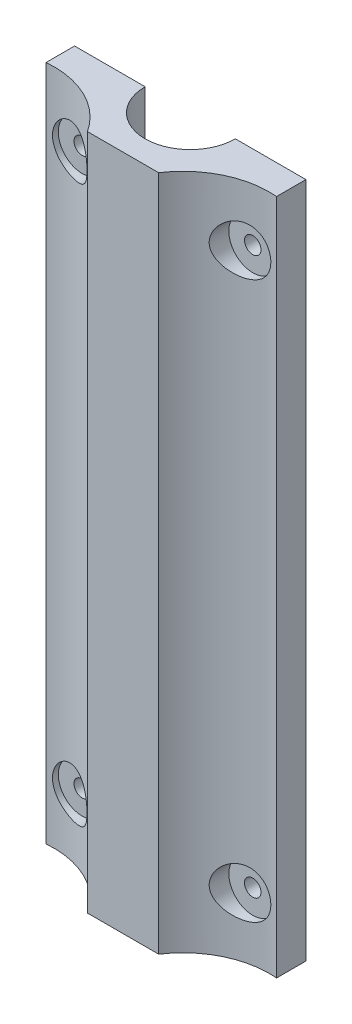
from build123d import *

# Parameters (mm, degrees)
ROTATION1_ANGLE                                     = 180
SCHNITT_LINEAR_AUSTRAGEN2_DEPTH                     = 92.33454987
SCHNITT_LINEAR_AUSTRAGEN2_DEPTH_BACK                = 90
SCHNITT_LINEAR_AUSTRAGEN3_DEPTH                     = 92.33454987
SCHNITT_LINEAR_AUSTRAGEN3_DEPTH_BACK                = 90
SKIZZE8_W                                           = 10
SKIZZE8_H                                           = 5
AUFSATZ_LINEAR_AUSTRAGEN2_DEPTH                     = 90
SKIZZE9_W                                           = 10
SKIZZE9_H                                           = 5
AUFSATZ_LINEAR_AUSTRAGEN3_DEPTH                     = 90
SKIZZE16_R                                          = 1.1
SCHNITT_LINEAR_AUSTRAGEN8_DEPTH                     = 93.717898057
SKIZZE18_R                                          = 4
SCHNITT_LINEAR_AUSTRAGEN9_DEPTH                     = 5
SKIZZE20_W                                          = 21.700648505
SKIZZE20_H                                          = 2
SCHNITT_LINEAR_AUSTRAGEN10_DEPTH                    = 93.717898057
SKIZZE22_R                                          = 11.608493419
SKIZZE22_R_2                                        = 11.500591483
SCHNITT_LINEAR_AUSTRAGEN17_DEPTH                    = 93.501938467
SKIZZE24_W                                          = 4
SKIZZE24_H                                          = 5
SCHNITT_LINEAR_AUSTRAGEN18_DEPTH                    = 93.501938467
STIRNSENKUNG_F_R_M2_SECHSKANTSCHRAUBE_G_D           = 2.2
STIRNSENKUNG_F_R_M2_SECHSKANTSCHRAUBE_G_DEPTH       = 12
STIRNSENKUNG_F_R_M2_SECHSKANTSCHRAUBE_G_CBORE_D     = 6.38
STIRNSENKUNG_F_R_M2_SECHSKANTSCHRAUBE_G_CBORE_DEPTH = 3.1
STIRNSENKUNG_F_R_M2_SECHSKANTSCHRAUBE_G_TIP         = 0.660946681


with BuildPart() as part:
    # Skizze3 → Rotation1 (revolve)
    with BuildSketch(Plane.XY):
        Polygon((0, 0), (-11, 0), (-11, 90), (-6, 90), (-6, 10), (0, 10), align=None)
    revolve(axis=Axis((0, 0, 0), (0, 1, 0)), revolution_arc=ROTATION1_ANGLE)

    # Skizze6 → Schnitt-Linear austragen2 (cut, two sides: drawn at the far end of the back side and taken through both)
    with BuildSketch(Plane(origin=(0, 90, 0), x_dir=(1, 0, 0), z_dir=(0, 1, 0)).offset(-SCHNITT_LINEAR_AUSTRAGEN2_DEPTH_BACK)):
        Polygon((-9.380624863, -62.0642209), (-9.380624863, -5.744900102), (-9.380624863, 0), (-9.380624863, 56.319320799), (-122.01926646, 56.319320799), (-122.01926646, -62.0642209), align=None)
    extrude(amount=SCHNITT_LINEAR_AUSTRAGEN2_DEPTH + SCHNITT_LINEAR_AUSTRAGEN2_DEPTH_BACK, mode=Mode.SUBTRACT)

    # Skizze7 → Schnitt-Linear austragen3 (cut, two sides: drawn at the far end of the back side and taken through both)
    with BuildSketch(Plane.XZ.offset(-SCHNITT_LINEAR_AUSTRAGEN3_DEPTH_BACK)):
        Polygon((9.380624863, 59.241313346), (9.380624863, 5.744900102), (9.380624863, 0), (9.380624863, -53.496413245), (116.373451353, -53.496413245), (116.373451353, 59.241313346), align=None)
    extrude(amount=SCHNITT_LINEAR_AUSTRAGEN3_DEPTH + SCHNITT_LINEAR_AUSTRAGEN3_DEPTH_BACK, mode=Mode.SUBTRACT)

    # Skizze8 → Aufsatz-Linear austragen2 (add)
    with BuildSketch(Plane(origin=(0, 90, 0), x_dir=(1, 0, 0), z_dir=(0, 1, 0))):
        with Locations((-14.380624863, -2.5)):
            Rectangle(SKIZZE8_W, SKIZZE8_H)
    extrude(amount=-AUFSATZ_LINEAR_AUSTRAGEN2_DEPTH)

    # Skizze9 → Aufsatz-Linear austragen3 (add)
    with BuildSketch(Plane(origin=(0, 90, 0), x_dir=(1, 0, 0), z_dir=(0, 1, 0))):
        with Locations((14.380624863, -2.5)):
            Rectangle(SKIZZE9_W, SKIZZE9_H)
    extrude(amount=-AUFSATZ_LINEAR_AUSTRAGEN3_DEPTH)

    # Skizze16 → Schnitt-Linear austragen8 (cut, through all)
    with BuildSketch(Plane.XZ):
        Circle(SKIZZE16_R)
    extrude(amount=-SCHNITT_LINEAR_AUSTRAGEN8_DEPTH, mode=Mode.SUBTRACT)

    # Skizze18 → Schnitt-Linear austragen9 (cut)
    with BuildSketch(Plane.XZ):
        Circle(SKIZZE18_R)
    extrude(amount=-SCHNITT_LINEAR_AUSTRAGEN9_DEPTH, mode=Mode.SUBTRACT)

    # Skizze20 → Schnitt-Linear austragen10 (cut, through all)
    with BuildSketch(Plane(origin=(0, 90, 0), x_dir=(1, 0, 0), z_dir=(0, 1, 0))):
        with Locations((-0.450220923, -10)):
            Rectangle(SKIZZE20_W, SKIZZE20_H)
    extrude(amount=-SCHNITT_LINEAR_AUSTRAGEN10_DEPTH, mode=Mode.SUBTRACT)

    # Skizze22 → Schnitt-Linear austragen17 (cut, through all)
    with BuildSketch(Plane(origin=(0, 90, 0), x_dir=(1, 0, 0), z_dir=(0, 1, 0))):
        with Locations((-14.380624863, -15.356814397)):
            Circle(SKIZZE22_R)
        with Locations((14.380624863, -15.356814397)):
            Circle(SKIZZE22_R_2)
    extrude(amount=-SCHNITT_LINEAR_AUSTRAGEN17_DEPTH, mode=Mode.SUBTRACT)

    # Skizze24 → Schnitt-Linear austragen18 (cut, through all)
    with BuildSketch(Plane(origin=(0, 90, 0), x_dir=(1, 0, 0), z_dir=(0, 1, 0))):
        with Locations((17.380624863, -2.5)):
            Rectangle(SKIZZE24_W, SKIZZE24_H)
        with Locations((-17.380624863, -2.5)):
            Rectangle(SKIZZE24_W, SKIZZE24_H)
    extrude(amount=-SCHNITT_LINEAR_AUSTRAGEN18_DEPTH, mode=Mode.SUBTRACT)

    # Stirnsenkung für M2 Sechskantschraube, Gewinde bis Kopf10
    with Locations(Plane(origin=(-0.023013558, 0, 6.13421813), x_dir=(-0.9999929625632231, 0, -0.0037516428439037797), z_dir=(-0.0037516428439037797, 0, 0.9999929625632231))):
        with Locations((11.36629237, -82), (11.36629237, -8), (-11.39514721, -8), (-11.39514721, -82)):
            CounterBoreHole(STIRNSENKUNG_F_R_M2_SECHSKANTSCHRAUBE_G_D / 2, STIRNSENKUNG_F_R_M2_SECHSKANTSCHRAUBE_G_CBORE_D / 2, STIRNSENKUNG_F_R_M2_SECHSKANTSCHRAUBE_G_CBORE_DEPTH, depth=STIRNSENKUNG_F_R_M2_SECHSKANTSCHRAUBE_G_DEPTH)
            with Locations((0, 0, -(STIRNSENKUNG_F_R_M2_SECHSKANTSCHRAUBE_G_DEPTH + STIRNSENKUNG_F_R_M2_SECHSKANTSCHRAUBE_G_TIP / 2))):  # 118° drill point
                Cone(0, STIRNSENKUNG_F_R_M2_SECHSKANTSCHRAUBE_G_D / 2, STIRNSENKUNG_F_R_M2_SECHSKANTSCHRAUBE_G_TIP, mode=Mode.SUBTRACT)


solid = part.part
